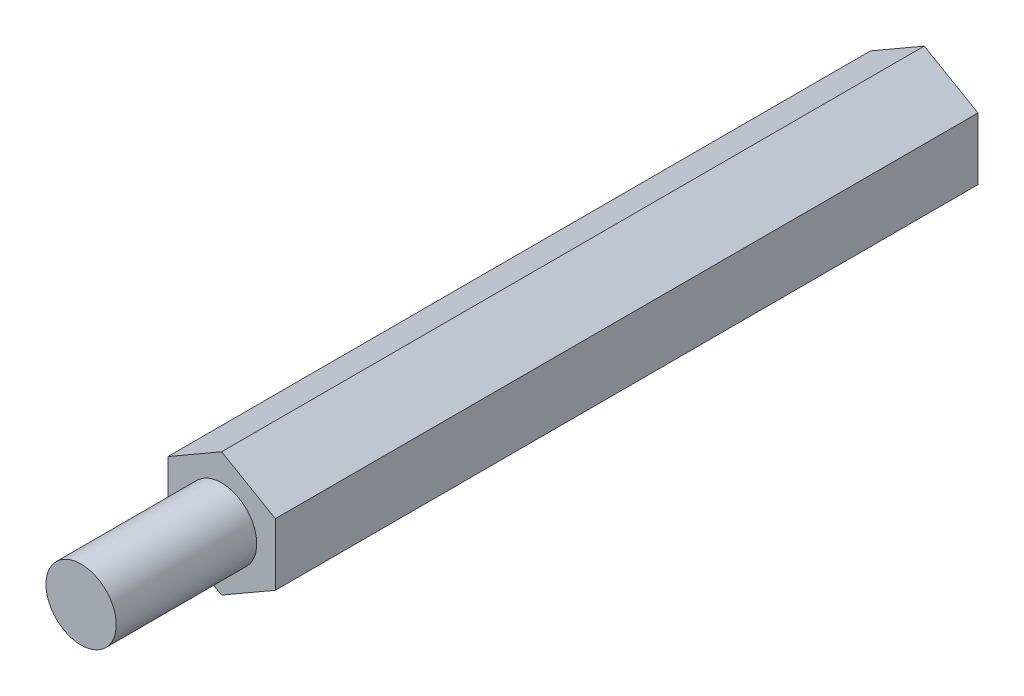
from build123d import *

# Parameters (mm, degrees)
BOSS_EXTRUDE1_DEPTH = 30
SKETCH2_R           = 1.5
CUT_EXTRUDE1_DEPTH  = 6
SKETCH3_R           = 1.5
BOSS_EXTRUDE2_DEPTH = 6


with BuildPart() as part:
    # Sketch1 → Boss-Extrude1 (new body)
    with BuildSketch(Plane.XY):
        Polygon((0, 2.65), (-2.29496732, 1.325), (-2.29496732, -1.325), (0, -2.65), (2.29496732, -1.325), (2.29496732, 1.325), align=None)
    extrude(amount=BOSS_EXTRUDE1_DEPTH)

    # Sketch2 → Cut-Extrude1 (cut)
    with BuildSketch(Plane(origin=(0, 0, 0), x_dir=(-1, 0, 0), z_dir=(0, 0, -1))):
        Circle(SKETCH2_R)
    extrude(amount=-CUT_EXTRUDE1_DEPTH, mode=Mode.SUBTRACT)

    # Sketch3 → Boss-Extrude2 (add)
    with BuildSketch(Plane.XY.offset(30)):
        with Locations(Location((0, 0, 0), (0, 0, 180))):
            Circle(SKETCH3_R)
    extrude(amount=BOSS_EXTRUDE2_DEPTH)


solid = part.part
